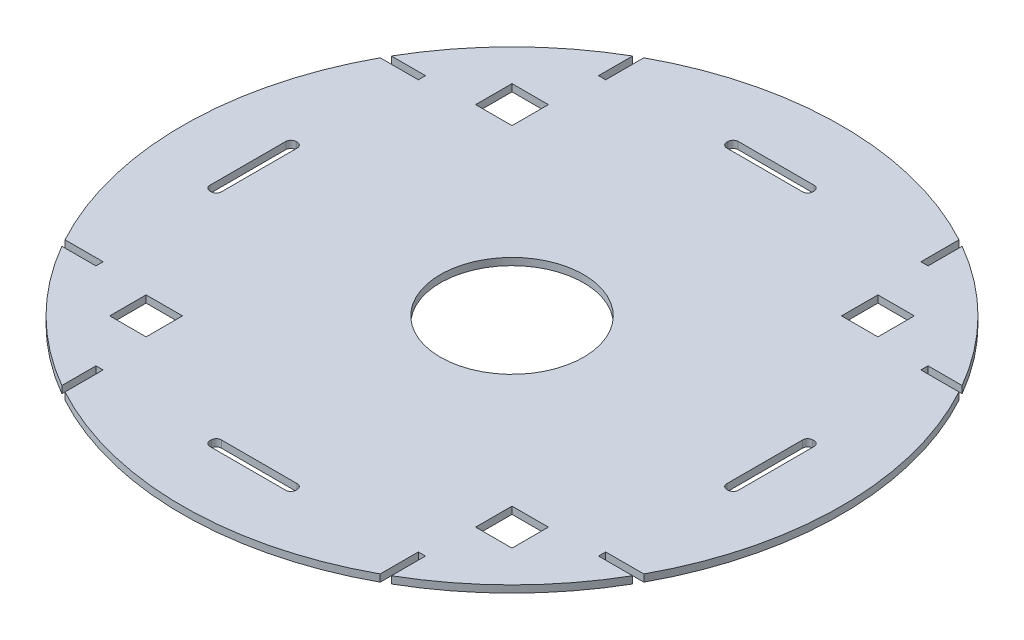
from build123d import *

# Parameters (mm, degrees)
SKETCH1_R           = 50
SKETCH1_W           = 25.4
SKETCH1_H           = 25.4
BOSS_EXTRUDE1_DEPTH = 5


with BuildPart() as part:
    # Sketch1 → Boss-Extrude1 (new body)
    with BuildSketch(Plane(origin=(0, 0, 0), x_dir=(1, 0, 0), z_dir=(0, 1, 0))):
        with BuildLine():
            Line((175.4, 110), (201.990098767, 110))
            ThreePointArc((201.990098767, 110), (230, 0), (201.990098767, -110))
            Line((201.990098767, -110), (175.4, -110))
            Line((175.4, -110), (175.4, -115))
            Line((175.4, -115), (199.18584287, -115))
            ThreePointArc((199.18584287, -115), (162.634559673, -162.634559673), (115, -199.18584287))
            Line((115, -199.18584287), (115, -175.4))
            Line((115, -175.4), (110, -175.4))
            Line((110, -175.4), (110, -201.990098767))
            ThreePointArc((110, -201.990098767), (0, -230), (-110, -201.990098767))
            Line((-110, -201.990098767), (-110, -175.4))
            Line((-110, -175.4), (-115, -175.4))
            Line((-115, -175.4), (-115, -199.18584287))
            ThreePointArc((-115, -199.18584287), (-162.634559673, -162.634559673), (-199.18584287, -115))
            Line((-199.18584287, -115), (-175.4, -115))
            Line((-175.4, -115), (-175.4, -110))
            Line((-175.4, -110), (-201.990098767, -110))
            ThreePointArc((-201.990098767, -110), (-230, 0), (-201.990098767, 110))
            Line((-201.990098767, 110), (-175.4, 110))
            Line((-175.4, 110), (-175.4, 115))
            Line((-175.4, 115), (-199.18584287, 115))
            ThreePointArc((-199.18584287, 115), (-162.634559673, 162.634559673), (-115, 199.18584287))
            Line((-115, 199.18584287), (-115, 175.4))
            Line((-115, 175.4), (-110, 175.4))
            Line((-110, 175.4), (-110, 201.990098767))
            ThreePointArc((-110, 201.990098767), (0, 230), (110, 201.990098767))
            Line((110, 201.990098767), (110, 175.4))
            Line((110, 175.4), (115, 175.4))
            Line((115, 175.4), (115, 199.18584287))
            ThreePointArc((115, 199.18584287), (162.634559673, 162.634559673), (199.18584287, 115))
            Line((199.18584287, 115), (175.4, 115))
            Line((175.4, 115), (175.4, 110))
        make_face()
        with Locations(Location((0, 0, 0), (0, 0, 270))):
            Circle(SKETCH1_R, mode=Mode.SUBTRACT)
        with Locations((127.7, 127.7)):
            Rectangle(SKETCH1_W, SKETCH1_H, mode=Mode.SUBTRACT)
        with Locations((-127.7, 127.7)):
            Rectangle(SKETCH1_W, SKETCH1_H, mode=Mode.SUBTRACT)
        with Locations((127.7, -127.7)):
            Rectangle(SKETCH1_W, SKETCH1_H, mode=Mode.SUBTRACT)
        with Locations((-127.7, -127.7)):
            Rectangle(SKETCH1_W, SKETCH1_H, mode=Mode.SUBTRACT)
        with BuildLine():
            Line((184.4, 26.5), (184.4, -26.5))
            ThreePointArc((184.4, -26.5), (183.374873734, -28.974873734), (180.9, -30))
            Line((180.9, -30), (179.9, -30))
            ThreePointArc((179.9, -30), (177.425126266, -28.974873734), (176.4, -26.5))
            Line((176.4, -26.5), (176.4, 26.5))
            ThreePointArc((176.4, 26.5), (177.425126266, 28.974873734), (179.9, 30))
            Line((179.9, 30), (180.9, 30))
            ThreePointArc((180.9, 30), (183.374873734, 28.974873734), (184.4, 26.5))
        make_face(mode=Mode.SUBTRACT)
        with BuildLine():
            Line((-26.5, 184.4), (26.5, 184.4))
            ThreePointArc((26.5, 184.4), (28.974873734, 183.374873734), (30, 180.9))
            Line((30, 180.9), (30, 179.9))
            ThreePointArc((30, 179.9), (28.974873734, 177.425126266), (26.5, 176.4))
            Line((26.5, 176.4), (-26.5, 176.4))
            ThreePointArc((-26.5, 176.4), (-28.974873734, 177.425126266), (-30, 179.9))
            Line((-30, 179.9), (-30, 180.9))
            ThreePointArc((-30, 180.9), (-28.974873734, 183.374873734), (-26.5, 184.4))
        make_face(mode=Mode.SUBTRACT)
        with BuildLine():
            Line((26.5, -184.4), (-26.5, -184.4))
            ThreePointArc((-26.5, -184.4), (-28.974873734, -183.374873734), (-30, -180.9))
            Line((-30, -180.9), (-30, -179.9))
            ThreePointArc((-30, -179.9), (-28.974873734, -177.425126266), (-26.5, -176.4))
            Line((-26.5, -176.4), (26.5, -176.4))
            ThreePointArc((26.5, -176.4), (28.974873734, -177.425126266), (30, -179.9))
            Line((30, -179.9), (30, -180.9))
            ThreePointArc((30, -180.9), (28.974873734, -183.374873734), (26.5, -184.4))
        make_face(mode=Mode.SUBTRACT)
        with BuildLine():
            Line((-184.4, -26.5), (-184.4, 26.5))
            ThreePointArc((-184.4, 26.5), (-183.374873734, 28.974873734), (-180.9, 30))
            Line((-180.9, 30), (-179.9, 30))
            ThreePointArc((-179.9, 30), (-177.425126266, 28.974873734), (-176.4, 26.5))
            Line((-176.4, 26.5), (-176.4, -26.5))
            ThreePointArc((-176.4, -26.5), (-177.425126266, -28.974873734), (-179.9, -30))
            Line((-179.9, -30), (-180.9, -30))
            ThreePointArc((-180.9, -30), (-183.374873734, -28.974873734), (-184.4, -26.5))
        make_face(mode=Mode.SUBTRACT)
    extrude(amount=BOSS_EXTRUDE1_DEPTH)


solid = part.part
